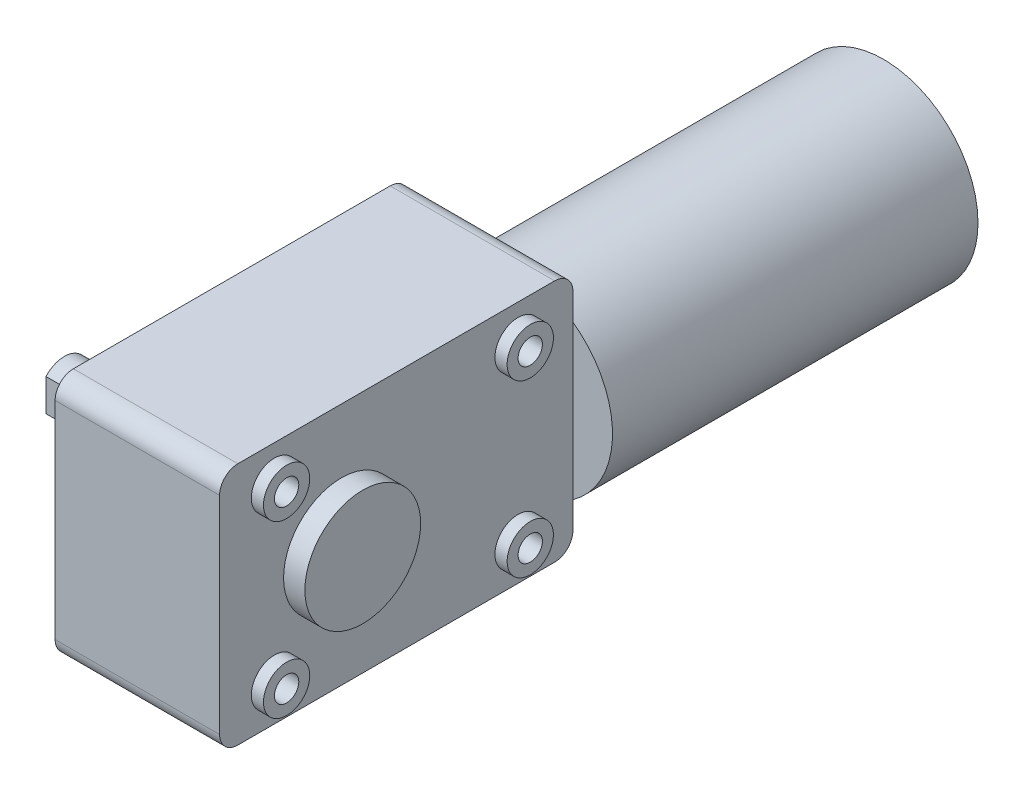
from build123d import *

# Parameters (mm, degrees)
SKETCH1_R                = 15.5
BOSS_EXTRUDE1_DEPTH      = 60
SKETCH2_R                = 6
BOSS_EXTRUDE2_DEPTH      = 2
SKETCH3_W                = 27
SKETCH3_H                = 58
BOSS_EXTRUDE3_DEPTH      = 20
SKETCH4_R                = 9.5
BOSS_EXTRUDE4_DEPTH      = 3.5
BOSS_EXTRUDE5_START      = 3.5
SKETCH6_R                = 9.5
BOSS_EXTRUDE5_DEPTH      = 3.5
SKETCH7_R                = 4
BOSS_EXTRUDE6_DEPTH      = 15
CUT_EXTRUDE1_START       = -14
CUT_EXTRUDE1_DEPTH       = 14
BOSS_EXTRUDE7_DEPTH      = 2
BOSS_EXTRUDE7_DEPTH_BACK = 29
SKETCH10_R               = 3.8
F_4_0MM_DOWEL_HOLE1_D    = 4
FILLET1_R                = 3


with BuildPart() as part:
    # Sketch1 → Boss-Extrude1 (new body)
    with BuildSketch(Plane.XY):
        Circle(SKETCH1_R)
    extrude(amount=BOSS_EXTRUDE1_DEPTH)

    # Sketch2 → Boss-Extrude2 (add)
    with BuildSketch(Plane(origin=(0, 0, 0), x_dir=(-1, 0, 0), z_dir=(0, 0, -1))):
        Circle(SKETCH2_R)
    extrude(amount=BOSS_EXTRUDE2_DEPTH)

    # Sketch3 → Boss-Extrude3 (add, symmetric)
    with BuildSketch(Plane(origin=(0, 0, 0), x_dir=(1, 0, 0), z_dir=(0, 1, 0))):
        with Locations((-4.5, -89)):
            Rectangle(SKETCH3_W, SKETCH3_H)
    extrude(amount=BOSS_EXTRUDE3_DEPTH, both=True)

    # Sketch4 → Boss-Extrude4 (add)
    with BuildSketch(Plane.ZY.offset(18)):
        with Locations(Location((98, 0, 0), (0, 0, 180))):
            Circle(SKETCH4_R)
    extrude(amount=BOSS_EXTRUDE4_DEPTH)

    # Sketch6 → Boss-Extrude5 (add)
    with BuildSketch(Plane(origin=(9, 0, 0), x_dir=(0, 0, -1), z_dir=(1, 0, 0)).offset(BOSS_EXTRUDE5_START)):
        with Locations((-98, 0)):
            Circle(SKETCH6_R)
    extrude(amount=-BOSS_EXTRUDE5_DEPTH)

    # Sketch7 → Boss-Extrude6 (add)
    with BuildSketch(Plane.ZY.offset(21.5)):
        with Locations((98, 0)):
            Circle(SKETCH7_R)
    extrude(amount=BOSS_EXTRUDE6_DEPTH)

    # Sketch8 → Cut-Extrude1 (cut)
    with BuildSketch(Plane.ZY.offset(36.5).offset(CUT_EXTRUDE1_START)):
        with BuildLine():
            Line((101, 2.645751311), (101, -2.645751311))
            ThreePointArc((101, -2.645751311), (102, 0), (101, 2.645751311))
        make_face()
    extrude(amount=CUT_EXTRUDE1_DEPTH, mode=Mode.SUBTRACT)

    # Sketch10 → Boss-Extrude7 (add, two sides: drawn at the far end of the back side and taken through both)
    with BuildSketch(Plane(origin=(9, 0, 0), x_dir=(0, 0, -1), z_dir=(1, 0, 0)).offset(-BOSS_EXTRUDE7_DEPTH_BACK)):
        with Locations((-69, 14)):
            Circle(SKETCH10_R)
        with Locations((-109, 14)):
            Circle(SKETCH10_R)
        with Locations((-69, -14)):
            Circle(SKETCH10_R)
        with Locations((-109, -14)):
            Circle(SKETCH10_R)
    extrude(amount=BOSS_EXTRUDE7_DEPTH + BOSS_EXTRUDE7_DEPTH_BACK)

    # Ø4.0mm Dowel Hole1 (through all)
    with Locations(Plane(origin=(11, 0, 0), x_dir=(0, 0, -1), z_dir=(1, 0, 0))):
        with Locations((-109, 14), (-69, 14), (-69, -14), (-109, -14)):
            Hole(F_4_0MM_DOWEL_HOLE1_D / 2)

    # Fillet1
    fillet1_edges = [part.edges().sort_by_distance(p)[0] for p in [
        (-4.5, -20, 60),
        (-4.5, -20, 118),
        (-4.5, 20, 60),
        (-4.5, 20, 118),
    ]]
    fillet(fillet1_edges, radius=FILLET1_R)


solid = part.part
